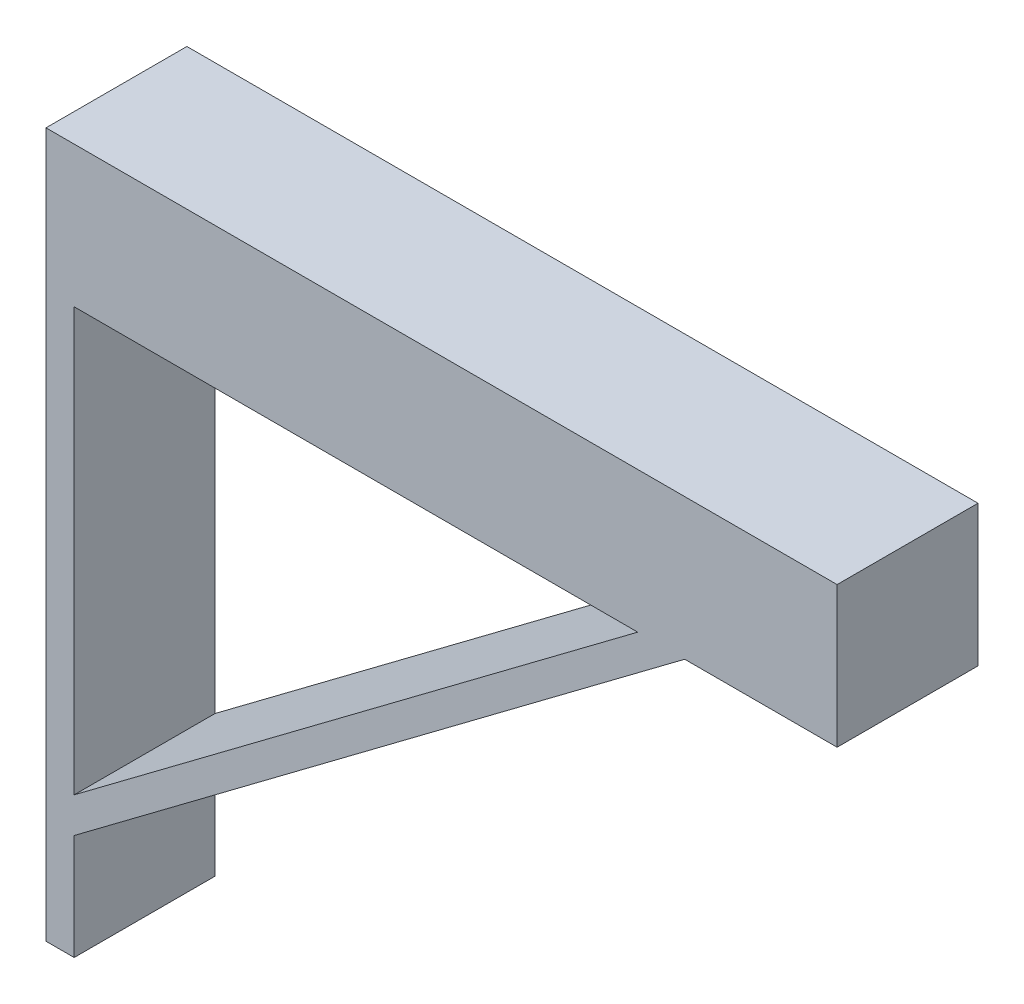
from build123d import *

# Parameters (mm, degrees)
BOSS_EXTRUDE1_DEPTH = 20


with BuildPart() as part:
    # Sketch1 → Boss-Extrude1 (new body)
    with BuildSketch(Plane.XY):
        Polygon((64.343956044, 33.516483516), (-43.956043956, 33.516483516), (-47.956043956, 33.516483516), (-47.956043956, -66.483516484), (-43.956043956, -66.483516484), (-43.956043956, -51.483516484), (42.710622711, 13.516483516), (64.343956044, 13.516483516), align=None)
        Polygon((36.043956044, 13.516483516), (-43.956043956, -46.483516484), (-43.956043956, 13.516483516), align=None, mode=Mode.SUBTRACT)
    extrude(amount=BOSS_EXTRUDE1_DEPTH)


solid = part.part
